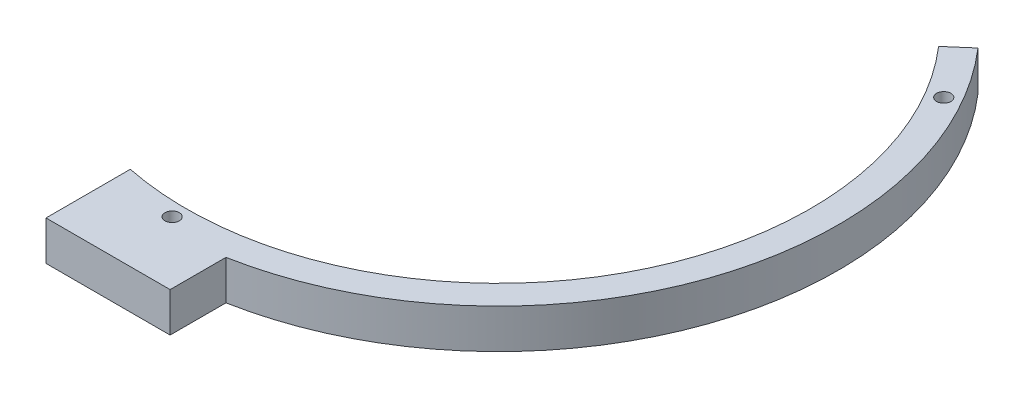
from build123d import *

# Parameters (mm, degrees)
SKETCH1_R           = 50.3
BOSS_EXTRUDE1_DEPTH = 6.35
CUT_EXTRUDE1_REACH  = 85.65
SKETCH2_R           = 1.15
CIRPATTERN1_COUNT   = 3
CUT_EXTRUDE2_REACH  = 85.65
SKETCH3_R           = 1.15


with BuildPart() as part:
    # Sketch1 → Boss-Extrude1 (new body)
    with BuildSketch(Plane(origin=(0, 0, 0), x_dir=(1, 0, 0), z_dir=(0, 1, 0))):
        with BuildLine():
            Line((-10, -53.87986637), (-10, -62.87986637))
            Line((-10, -62.87986637), (10, -62.87986637))
            Line((10, -62.87986637), (10, -53.87986637))
            ThreePointArc((10, -53.87986637), (0, 54.8), (-10, -53.87986637))
        make_face()
        with Locations(Location((0, 0, 0), (0, 0, 270))):
            Circle(SKETCH1_R, mode=Mode.SUBTRACT)
    extrude(amount=BOSS_EXTRUDE1_DEPTH)

    # Sketch2 → Cut-Extrude1 (cut, up to next)
    with BuildSketch(Plane(origin=(0, 6.35, 0), x_dir=(1, 0, 0), z_dir=(0, 1, 0)), mode=Mode.PRIVATE) as cut_extrude1_sk1:
        with Locations(Location((0, -52.55, 0), (0, 0, 270))):
            Circle(SKETCH2_R)
    cut_extrude1_tool1 = extrude(cut_extrude1_sk1.sketch, amount=-CUT_EXTRUDE1_REACH, mode=Mode.PRIVATE) & part.part
    cut_extrude1 = cut_extrude1_tool1.solids().sort_by_distance((0, 6.35, 52.55))[0]
    add(cut_extrude1, mode=Mode.SUBTRACT)

    # CirPattern1: Cut-Extrude1 ×3 about axis
    cirpattern1_axis = Axis((0, 0, 0), (0, 1, 0))
    for i in range(1, CIRPATTERN1_COUNT):
        add(cut_extrude1.rotate(cirpattern1_axis, i * 360 / CIRPATTERN1_COUNT), mode=Mode.SUBTRACT)

    # Sketch3 → Cut-Extrude2 (cut, up to next)
    with BuildSketch(Plane(origin=(0, 6.35, 0), x_dir=(1, 0, 0), z_dir=(0, 1, 0)), mode=Mode.PRIVATE) as cut_extrude2_sk1:
        with BuildLine():
            ThreePointArc((41.376904985, 35.930373417), (-47.56676712, 27.21107616), (-10, -53.87986637))
            Line((-10, -53.87986637), (-10, -49.295943038))
            ThreePointArc((-10, -49.295943038), (-43.451541655, 25.338775184), (37.979166437, 32.979886548))
            Line((37.979166437, 32.979886548), (41.376904985, 35.930373417))
        make_face()
        with Locations((-45.509634969, 26.275)):
            Circle(SKETCH3_R, mode=Mode.SUBTRACT)
    cut_extrude2_tool1 = extrude(cut_extrude2_sk1.sketch, amount=-CUT_EXTRUDE2_REACH, mode=Mode.PRIVATE) & part.part
    add(cut_extrude2_tool1.solids().sort_by_distance((-43.576908, 6.35, -25.411882))[0], mode=Mode.SUBTRACT)


solid = part.part
